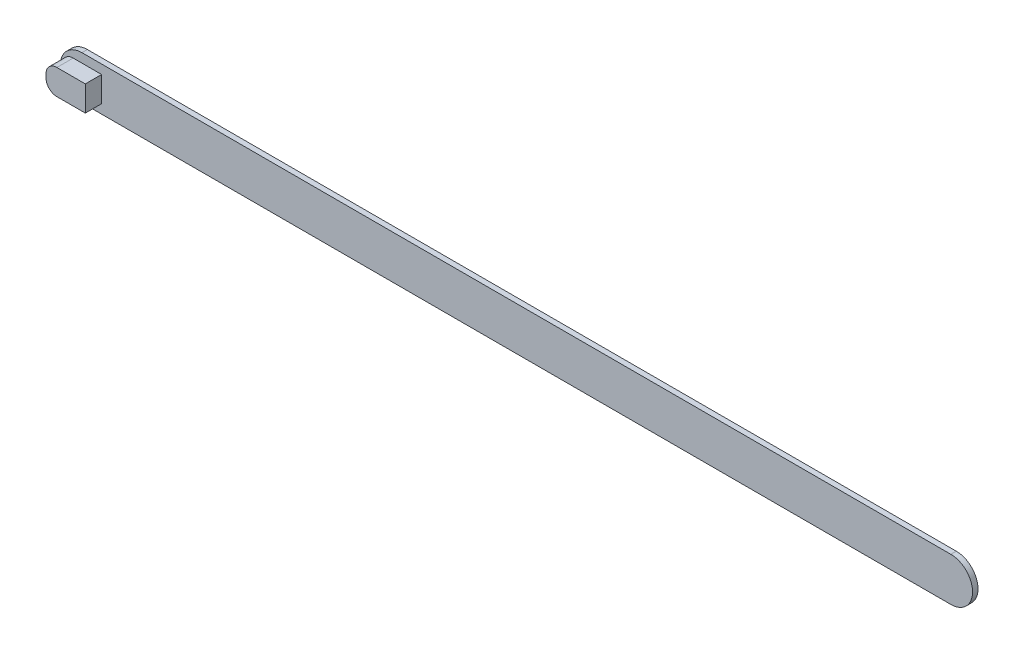
from build123d import *

# Parameters (mm, degrees)
BOSS_EXTRU_1_DEPTH = 0.5
BOSS_EXTRU_2_DEPTH = 1.5


with BuildPart() as part:
    # Esquisse1 → Boss.-Extru.1 (new body)
    with BuildSketch(Plane.XY):
        with BuildLine():
            Line((0, -2), (80, -2))
            ThreePointArc((80, -2), (82, 0), (80, 2))
            Line((80, 2), (0, 2))
            ThreePointArc((0, 2), (-2, 0), (0, -2))
        make_face()
    extrude(amount=BOSS_EXTRU_1_DEPTH)

    # Esquisse2 → Boss.-Extru.2 (add)
    with BuildSketch(Plane.XY.offset(0.5)):
        with BuildLine():
            Line((-0.809863383, -1.164625511), (1.809863383, -1.164625511))
            Line((1.809863383, -1.164625511), (1.809863383, 1.164625511))
            Line((1.809863383, 1.164625511), (-0.809863383, 1.164625511))
            ThreePointArc((-0.809863383, 1.164625511), (-1.516970164, 0.871732292), (-1.809863383, 0.164625511))
            Line((-1.809863383, 0.164625511), (-1.809863383, -0.164625511))
            ThreePointArc((-1.809863383, -0.164625511), (-1.516970164, -0.871732292), (-0.809863383, -1.164625511))
        make_face()
    extrude(amount=BOSS_EXTRU_2_DEPTH)


solid = part.part
